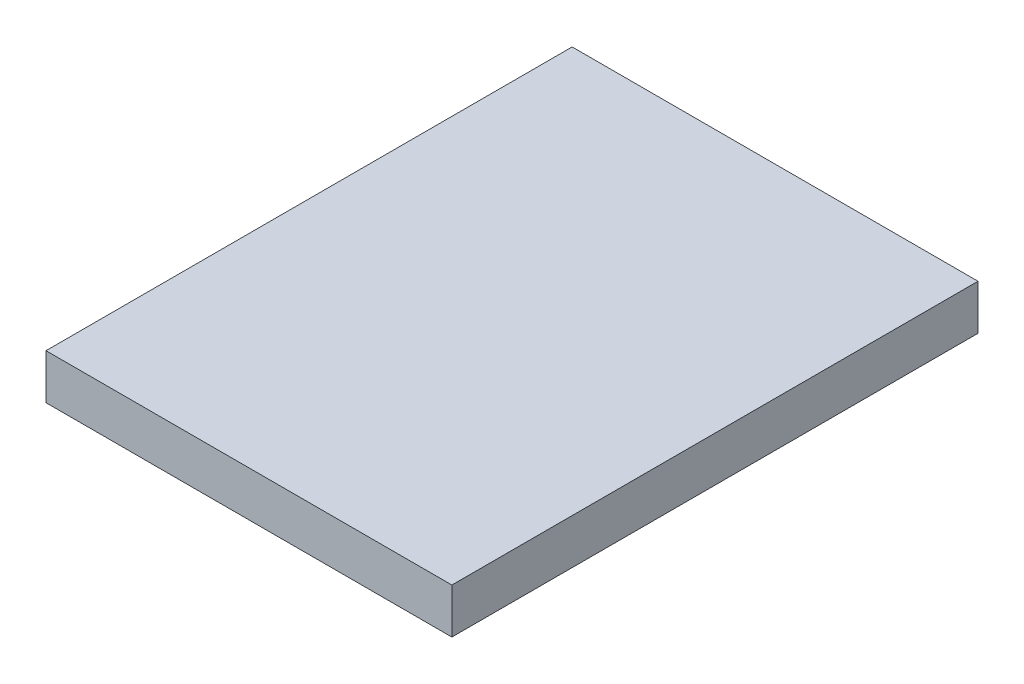
from build123d import *

# Parameters (mm, degrees)
CROQUIS1_W              = 2700
CROQUIS1_H              = 3500
SALIENTE_EXTRUIR1_DEPTH = 300


with BuildPart() as part:
    # Croquis1 → Saliente-Extruir1 (new body)
    with BuildSketch(Plane(origin=(0, 0, 0), x_dir=(1, 0, 0), z_dir=(0, 1, 0))):
        with Locations((1350, 1750)):
            Rectangle(CROQUIS1_W, CROQUIS1_H)
    extrude(amount=SALIENTE_EXTRUIR1_DEPTH)


solid = part.part
